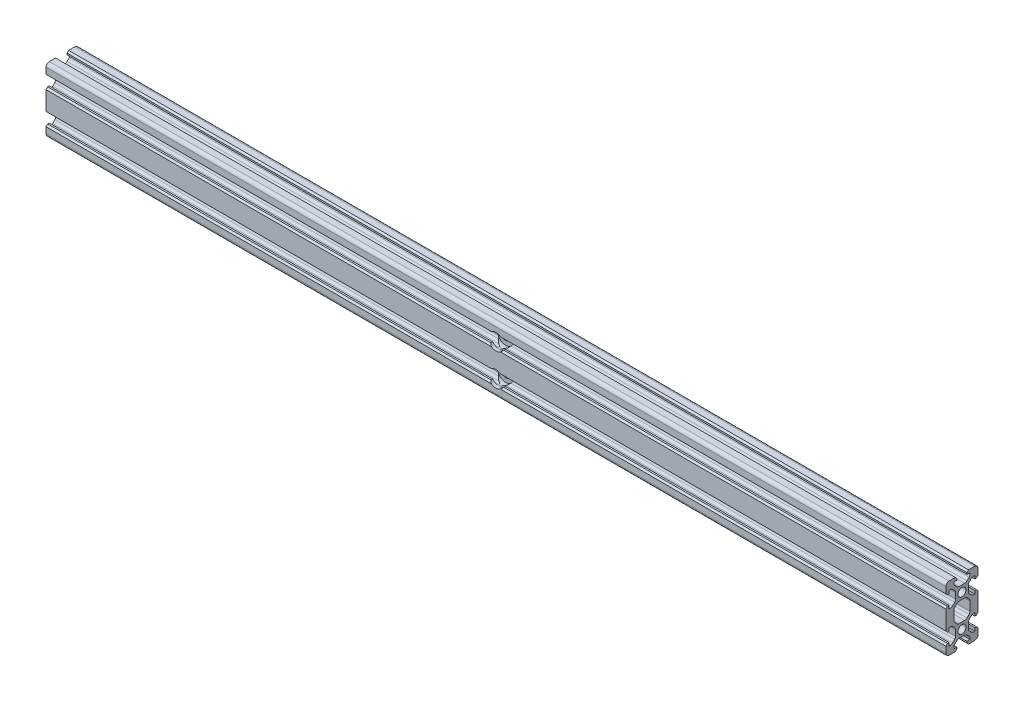
from build123d import *

# Parameters (mm, degrees)
SKETCH1_R           = 2.5
BOSS_EXTRUDE1_DEPTH = 560
SKETCH2_R           = 2.5
CUT_EXTRUDE1_DEPTH  = 562.782876208
SKETCH3_R           = 5
CUT_EXTRUDE2_DEPTH  = 6.1


with BuildPart() as part:
    # Sketch1 → Boss-Extrude1 (new body)
    with BuildSketch(Plane(origin=(0, 0, 0), x_dir=(0, 0, -1), z_dir=(1, 0, 0))):
        with BuildLine():
            Line((6.9, 38), (5, 38))
            Line((5, 38), (5, 37.242640687))
            ThreePointArc((5, 37.242640687), (5.152240935, 36.477273822), (5.585786438, 35.828427125))
            Line((5.585786438, 35.828427125), (6.876358939, 34.537854624))
            ThreePointArc((6.876358939, 34.537854624), (7.525205636, 34.104309121), (8.290572501, 33.952068186))
            Line((8.290572501, 33.952068186), (11.709427499, 33.952068186))
            ThreePointArc((11.709427499, 33.952068186), (12.474794364, 34.104309121), (13.123641061, 34.537854624))
            Line((13.123641061, 34.537854624), (14.414213562, 35.828427125))
            ThreePointArc((14.414213562, 35.828427125), (14.847759065, 36.477273822), (15, 37.242640687))
            Line((15, 37.242640687), (15, 38))
            Line((15, 38), (13.1, 38))
            Line((13.1, 38), (13.1, 39))
            Line((13.1, 39), (14.1, 40))
            Line((14.1, 40), (18, 40))
            ThreePointArc((18, 40), (19.414213562, 39.414213562), (20, 38))
            Line((20, 38), (20, 34.1))
            Line((20, 34.1), (19, 33.1))
            Line((19, 33.1), (18, 33.1))
            Line((18, 33.1), (18, 35))
            Line((18, 35), (17.242640687, 35))
            ThreePointArc((17.242640687, 35), (16.477273822, 34.847759065), (15.828427125, 34.414213562))
            Line((15.828427125, 34.414213562), (14.537854624, 33.123641061))
            ThreePointArc((14.537854624, 33.123641061), (14.104309121, 32.474794364), (13.952068186, 31.709427499))
            Line((13.952068186, 31.709427499), (13.952068186, 28.290572501))
            ThreePointArc((13.952068186, 28.290572501), (14.104309121, 27.525205636), (14.537854624, 26.876358939))
            Line((14.537854624, 26.876358939), (15.828427125, 25.585786438))
            ThreePointArc((15.828427125, 25.585786438), (16.477273822, 25.152240935), (17.242640687, 25))
            Line((17.242640687, 25), (18, 25))
            Line((18, 25), (18, 26.9))
            Line((18, 26.9), (19, 26.9))
            Line((19, 26.9), (20, 25.9))
            Line((20, 25.9), (20, 14.1))
            Line((20, 14.1), (19, 13.1))
            Line((19, 13.1), (18, 13.1))
            Line((18, 13.1), (18, 15))
            Line((18, 15), (17.242640687, 15))
            ThreePointArc((17.242640687, 15), (16.477273822, 14.847759065), (15.828427125, 14.414213562))
            Line((15.828427125, 14.414213562), (14.537854624, 13.123641061))
            ThreePointArc((14.537854624, 13.123641061), (14.104309121, 12.474794364), (13.952068186, 11.709427499))
            Line((13.952068186, 11.709427499), (13.952068186, 8.290572501))
            ThreePointArc((13.952068186, 8.290572501), (14.104309121, 7.525205636), (14.537854624, 6.876358939))
            Line((14.537854624, 6.876358939), (15.828427125, 5.585786438))
            ThreePointArc((15.828427125, 5.585786438), (16.477273822, 5.152240935), (17.242640687, 5))
            Line((17.242640687, 5), (18, 5))
            Line((18, 5), (18, 6.9))
            Line((18, 6.9), (19, 6.9))
            Line((19, 6.9), (20, 5.9))
            Line((20, 5.9), (20, 2))
            ThreePointArc((20, 2), (19.414213562, 0.585786438), (18, 0))
            Line((18, 0), (14.1, 0))
            Line((14.1, 0), (13.1, 1))
            Line((13.1, 1), (13.1, 2))
            Line((13.1, 2), (15, 2))
            Line((15, 2), (15, 2.757359313))
            ThreePointArc((15, 2.757359313), (14.847759065, 3.522726178), (14.414213562, 4.171572875))
            Line((14.414213562, 4.171572875), (13.123641061, 5.462145376))
            ThreePointArc((13.123641061, 5.462145376), (12.474794364, 5.895690879), (11.709427499, 6.047931814))
            Line((11.709427499, 6.047931814), (8.290572501, 6.047931814))
            ThreePointArc((8.290572501, 6.047931814), (7.525205636, 5.895690879), (6.876358939, 5.462145376))
            Line((6.876358939, 5.462145376), (5.585786438, 4.171572875))
            ThreePointArc((5.585786438, 4.171572875), (5.152240935, 3.522726178), (5, 2.757359313))
            Line((5, 2.757359313), (5, 2))
            Line((5, 2), (6.9, 2))
            Line((6.9, 2), (6.9, 1))
            Line((6.9, 1), (5.9, 0))
            Line((5.9, 0), (2, 0))
            ThreePointArc((2, 0), (0.585786438, 0.585786438), (0, 2))
            Line((0, 2), (0, 5.9))
            Line((0, 5.9), (1, 6.9))
            Line((1, 6.9), (2, 6.9))
            Line((2, 6.9), (2, 5))
            Line((2, 5), (2.757359313, 5))
            ThreePointArc((2.757359313, 5), (3.522726178, 5.152240935), (4.171572875, 5.585786438))
            Line((4.171572875, 5.585786438), (5.462145376, 6.876358939))
            ThreePointArc((5.462145376, 6.876358939), (5.895690879, 7.525205636), (6.047931814, 8.290572501))
            Line((6.047931814, 8.290572501), (6.047931814, 11.709427499))
            ThreePointArc((6.047931814, 11.709427499), (5.895690879, 12.474794364), (5.462145376, 13.123641061))
            Line((5.462145376, 13.123641061), (4.171572875, 14.414213562))
            ThreePointArc((4.171572875, 14.414213562), (3.522726178, 14.847759065), (2.757359313, 15))
            Line((2.757359313, 15), (2, 15))
            Line((2, 15), (2, 13.1))
            Line((2, 13.1), (1, 13.1))
            Line((1, 13.1), (0, 14.1))
            Line((0, 14.1), (0, 25.9))
            Line((0, 25.9), (1, 26.9))
            Line((1, 26.9), (2, 26.9))
            Line((2, 26.9), (2, 25))
            Line((2, 25), (2.757359313, 25))
            ThreePointArc((2.757359313, 25), (3.522726178, 25.152240935), (4.171572875, 25.585786438))
            Line((4.171572875, 25.585786438), (5.462145376, 26.876358939))
            ThreePointArc((5.462145376, 26.876358939), (5.895690879, 27.525205636), (6.047931814, 28.290572501))
            Line((6.047931814, 28.290572501), (6.047931814, 31.709427499))
            ThreePointArc((6.047931814, 31.709427499), (5.895690879, 32.474794364), (5.462145376, 33.123641061))
            Line((5.462145376, 33.123641061), (4.171572875, 34.414213562))
            ThreePointArc((4.171572875, 34.414213562), (3.522726178, 34.847759065), (2.757359313, 35))
            Line((2.757359313, 35), (2, 35))
            Line((2, 35), (2, 33.1))
            Line((2, 33.1), (1, 33.1))
            Line((1, 33.1), (0, 34.1))
            Line((0, 34.1), (0, 38))
            ThreePointArc((0, 38), (0.585786438, 39.414213562), (2, 40))
            Line((2, 40), (5.9, 40))
            Line((5.9, 40), (6.9, 39))
            Line((6.9, 39), (6.9, 38))
        make_face()
        with Locations((10, 10)):
            Circle(SKETCH1_R, mode=Mode.SUBTRACT)
        with Locations((10, 30)):
            Circle(SKETCH1_R, mode=Mode.SUBTRACT)
        with BuildLine():
            Line((14.414213562, 15.828427125), (13.123641061, 14.537854624))
            ThreePointArc((13.123641061, 14.537854624), (12.474794364, 14.104309121), (11.709427499, 13.952068186))
            Line((11.709427499, 13.952068186), (8.290572501, 13.952068186))
            ThreePointArc((8.290572501, 13.952068186), (7.525205636, 14.104309121), (6.876358939, 14.537854624))
            Line((6.876358939, 14.537854624), (5.585786438, 15.828427125))
            ThreePointArc((5.585786438, 15.828427125), (5.152240935, 16.477273822), (5, 17.242640687))
            Line((5, 17.242640687), (5, 22.757359313))
            ThreePointArc((5, 22.757359313), (5.152240935, 23.522726178), (5.585786438, 24.171572875))
            Line((5.585786438, 24.171572875), (6.876358939, 25.462145376))
            ThreePointArc((6.876358939, 25.462145376), (7.525205636, 25.895690879), (8.290572501, 26.047931814))
            Line((8.290572501, 26.047931814), (11.709427499, 26.047931814))
            ThreePointArc((11.709427499, 26.047931814), (12.474794364, 25.895690879), (13.123641061, 25.462145376))
            Line((13.123641061, 25.462145376), (14.414213562, 24.171572875))
            ThreePointArc((14.414213562, 24.171572875), (14.847759065, 23.522726178), (15, 22.757359313))
            Line((15, 22.757359313), (15, 17.242640687))
            ThreePointArc((15, 17.242640687), (14.847759065, 16.477273822), (14.414213562, 15.828427125))
        make_face(mode=Mode.SUBTRACT)
    extrude(amount=BOSS_EXTRUDE1_DEPTH)

    # Sketch2 → Cut-Extrude1 (cut, through all)
    with BuildSketch(Plane.XY):
        with Locations(Location((280, 30, 0), (0, 0, 316.860970278))):
            Circle(SKETCH2_R)
        with Locations(Location((280, 10, 0), (0, 0, 316.860970278))):
            Circle(SKETCH2_R)
    extrude(amount=-CUT_EXTRUDE1_DEPTH, mode=Mode.SUBTRACT)

    # Sketch3 → Cut-Extrude2 (cut)
    with BuildSketch(Plane.XY):
        with Locations((280, 30)):
            Circle(SKETCH3_R)
        with Locations((280, 10)):
            Circle(SKETCH3_R)
    extrude(amount=-CUT_EXTRUDE2_DEPTH, mode=Mode.SUBTRACT)


solid = part.part
